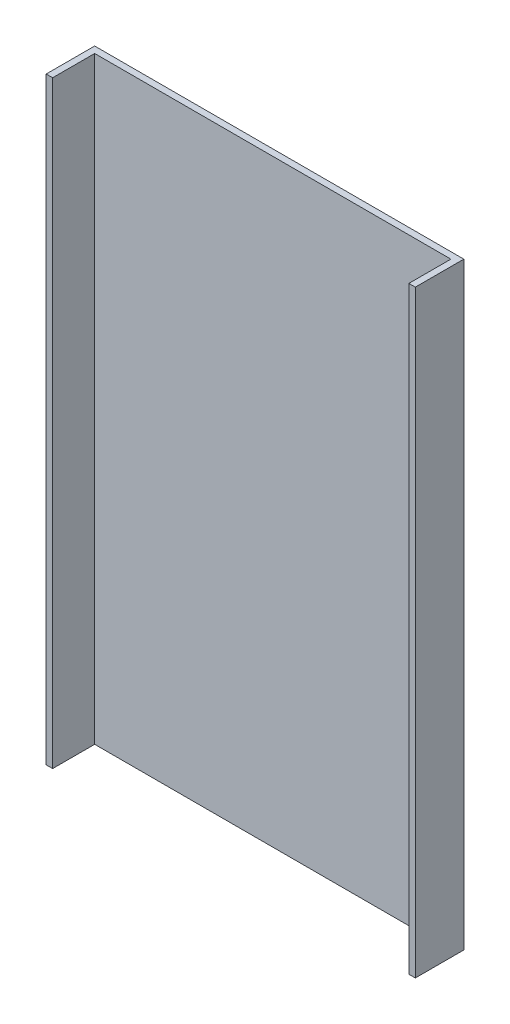
from build123d import *

# Parameters (mm, degrees)
SKETCH1_W           = 72.46
SKETCH1_H           = 117.44
BOSS_EXTRUDE1_DEPTH = 1.27
SKETCH2_W           = 1.27
SKETCH2_H           = 117.44
BOSS_EXTRUDE2_DEPTH = 8.25


with BuildPart() as part:
    # Sketch1 → Boss-Extrude1 (new body)
    with BuildSketch(Plane.XY):
        with Locations((36.23, 58.72)):
            Rectangle(SKETCH1_W, SKETCH1_H)
    extrude(amount=BOSS_EXTRUDE1_DEPTH)

    # Sketch2 → Boss-Extrude2 (add)
    with BuildSketch(Plane.XY.offset(1.27)):
        with Locations((0.635, 58.72)):
            Rectangle(SKETCH2_W, SKETCH2_H)
        with Locations((71.825, 58.72)):
            Rectangle(SKETCH2_W, SKETCH2_H)
    extrude(amount=BOSS_EXTRUDE2_DEPTH)


solid = part.part
